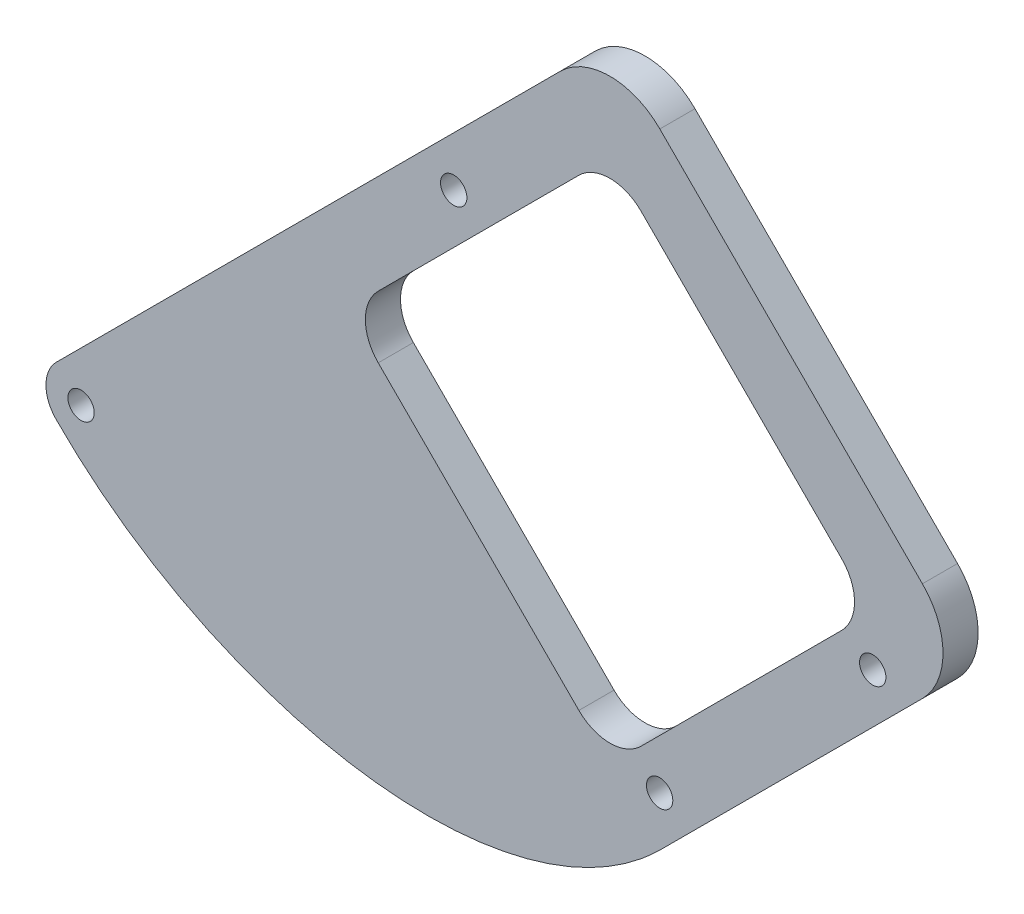
from build123d import *

# Parameters (mm, degrees)
SKETCH1_R           = 1.5
BOSS_EXTRUDE1_DEPTH = 4
FILLET1_R           = 5


with BuildPart() as part:
    # Sketch1 → Boss-Extrude1 (new body)
    with BuildSketch(Plane.XY):
        with BuildLine():
            Line((-20.616075737, 20.616075737), (-63.042482608, -21.810331134))
            ThreePointArc((-63.042482608, -21.810331134), (-64.214055483, -24.638758259), (-63.042482608, -27.467185384))
            add(Edge.make_bspline(
                [(-63.042482608, -27.467185384), (-44.475149979, -46.28503097), (-11.38960692, -52.316770126), (5.656854249, -35.575297224)],
                knots=[0, 0, 0, 0, 1, 1, 1, 1], degree=3))
            Line((5.656854249, -35.575297224), (8.485658906, -32.746492568))
            Line((8.485658906, -32.746492568), (32.746492568, -8.485658906))
            Line((32.746492568, -8.485658906), (35.575297224, -5.656854249))
            ThreePointArc((35.575297224, -5.656854249), (37.918442975, 0), (35.575297224, 5.656854249))
            Line((35.575297224, 5.656854249), (5.680184525, 35.551966949))
            ThreePointArc((5.680184525, 35.551966949), (0.032993992, 37.918442975), (-5.633523974, 35.5986275))
            Line((-5.633523974, 35.5986275), (-20.616075737, 20.616075737))
        make_face()
        with Locations((29.918065443, -5.657231781)):
            Circle(SKETCH1_R, mode=Mode.SUBTRACT)
        with Locations((5.657231781, -29.918065443)):
            Circle(SKETCH1_R, mode=Mode.SUBTRACT)
        with Locations((-17.787648612, 17.787648612)):
            Circle(SKETCH1_R, mode=Mode.SUBTRACT)
        with Locations((-60.214055483, -24.638758259)):
            Circle(SKETCH1_R, mode=Mode.SUBTRACT)
        Polygon((29.918442975, 0), (0, -29.918442975), (-29.918442975, 0), (-14.959221487, 14.959221487), (0, 29.918442975), align=None, mode=Mode.SUBTRACT)
    extrude(amount=BOSS_EXTRUDE1_DEPTH)

    # Fillet1
    fillet1_edges = [part.edges().sort_by_distance(p)[0] for p in [
        (-29.918442975, 0, 2),
        (0, -29.918442975, 2),
        (29.918442975, 0, 2),
        (0, 29.918442975, 2),
    ]]
    fillet(fillet1_edges, radius=FILLET1_R)


solid = part.part
